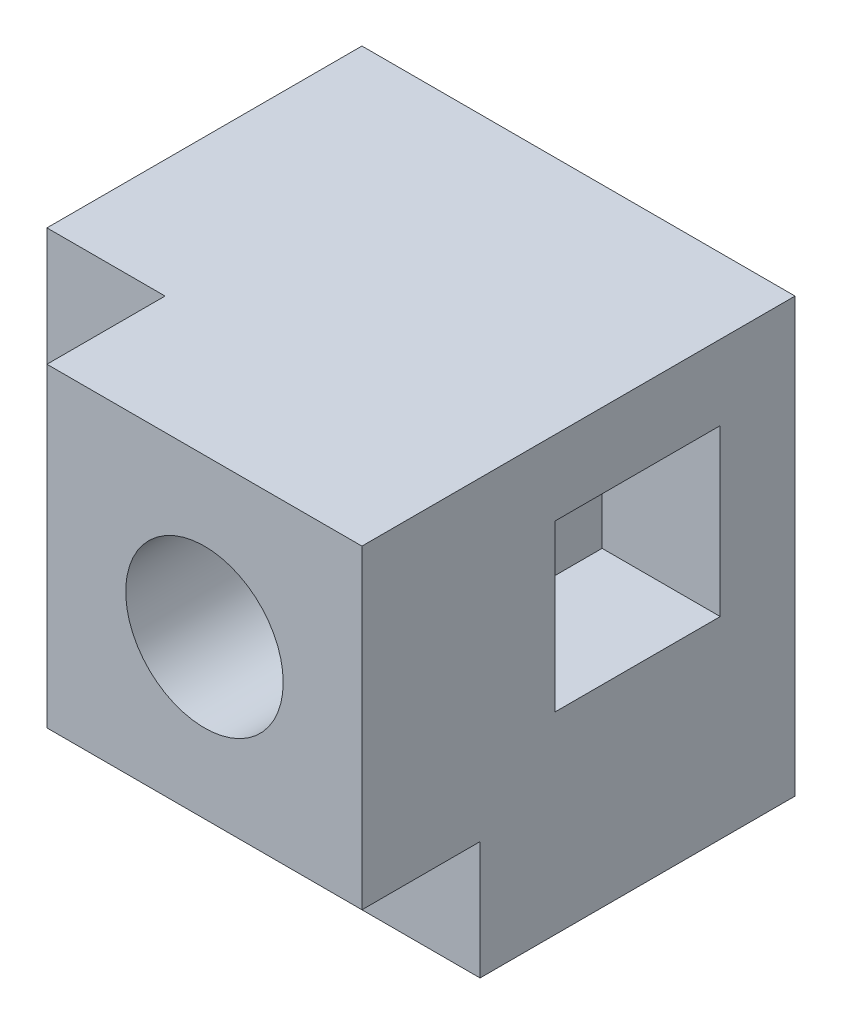
from build123d import *

# Parameters (mm, degrees)
ESQUISSE2_W             = 80
ESQUISSE2_H             = 80
BOSS_EXTRU_1_DEPTH      = 80
ESQUISSE5_W             = 80
ESQUISSE5_H             = 80
BOSS_EXTRU_2_DEPTH      = 30
ESQUISSE6_W             = 80
ESQUISSE6_H             = 80
BOSS_EXTRU_3_DEPTH      = 30
ESQUISSE7_W             = 80
ESQUISSE7_H             = 80
BOSS_EXTRU_4_DEPTH      = 30
ESQUISSE8_R             = 20
ENL_V_MAT_EXTRU_1_DEPTH = 45
ESQUISSE9_R             = 20
ENL_V_MAT_EXTRU_2_DEPTH = 45
ESQUISSE10_R            = 20
ENL_V_MAT_EXTRU_3_DEPTH = 45
ESQUISSE11_W            = 42
ESQUISSE11_H            = 42
ENL_V_MAT_EXTRU_4_DEPTH = 30


with BuildPart() as part:
    # Esquisse2 → Boss.-Extru.1 (new body)
    with BuildSketch(Plane(origin=(0, 0, 0), x_dir=(1, 0, 0), z_dir=(0, 1, 0))):
        Rectangle(ESQUISSE2_W, ESQUISSE2_H)
    extrude(amount=BOSS_EXTRU_1_DEPTH)

    # Esquisse5 → Boss.-Extru.2 (add)
    with BuildSketch(Plane.ZY.offset(40)):
        with Locations((0, 40)):
            Rectangle(ESQUISSE5_W, ESQUISSE5_H)
    extrude(amount=BOSS_EXTRU_2_DEPTH)

    # Esquisse6 → Boss.-Extru.3 (add)
    with BuildSketch(Plane.XY.offset(40)):
        with Locations((0, 40)):
            Rectangle(ESQUISSE6_W, ESQUISSE6_H)
    extrude(amount=BOSS_EXTRU_3_DEPTH)

    # Esquisse7 → Boss.-Extru.4 (add)
    with BuildSketch(Plane.XZ):
        Rectangle(ESQUISSE7_W, ESQUISSE7_H)
    extrude(amount=BOSS_EXTRU_4_DEPTH)

    # Esquisse8 → Enlèv. mat.-Extru.1 (cut)
    with BuildSketch(Plane.ZY.offset(70)):
        with Locations((0, 40)):
            Circle(ESQUISSE8_R)
    extrude(amount=-ENL_V_MAT_EXTRU_1_DEPTH, mode=Mode.SUBTRACT)

    # Esquisse9 → Enlèv. mat.-Extru.2 (cut)
    with BuildSketch(Plane.XY.offset(70)):
        with Locations((0, 40)):
            Circle(ESQUISSE9_R)
    extrude(amount=-ENL_V_MAT_EXTRU_2_DEPTH, mode=Mode.SUBTRACT)

    # Esquisse10 → Enlèv. mat.-Extru.3 (cut)
    with BuildSketch(Plane.XZ.offset(30)):
        with Locations(Location((0, 0, 0), (0, 0, 270))):
            Circle(ESQUISSE10_R)
    extrude(amount=-ENL_V_MAT_EXTRU_3_DEPTH, mode=Mode.SUBTRACT)

    # Esquisse11 → Enlèv. mat.-Extru.4 (cut)
    with BuildSketch(Plane(origin=(40, 0, 0), x_dir=(0, 0, -1), z_dir=(1, 0, 0))):
        with Locations((0, 40)):
            Rectangle(ESQUISSE11_W, ESQUISSE11_H)
    extrude(amount=-ENL_V_MAT_EXTRU_4_DEPTH, mode=Mode.SUBTRACT)


solid = part.part
